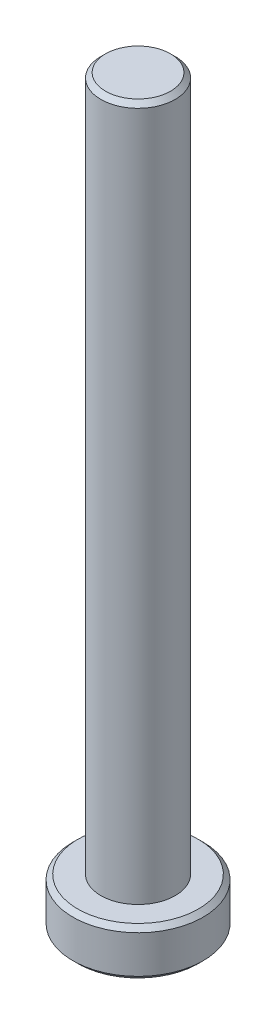
from build123d import *

# Parameters (mm, degrees)
SKETCH1_R           = 2
BOSS_EXTRUDE1_DEPTH = 37.338
SKETCH2_R           = 3.5
BOSS_EXTRUDE2_DEPTH = 2.54
CHAMFER1_SIZE       = 0.254
CHAMFER2_SIZE       = 0.254
CHAMFER3_SIZE       = 0.254


with BuildPart() as part:
    # Sketch1 → Boss-Extrude1 (new body)
    with BuildSketch(Plane(origin=(0, 0, 0), x_dir=(1, 0, 0), z_dir=(0, 1, 0))):
        with Locations(Location((0, 0, 0), (0, 0, 270))):
            Circle(SKETCH1_R)
    extrude(amount=BOSS_EXTRUDE1_DEPTH)

    # Sketch2 → Boss-Extrude2 (add)
    with BuildSketch(Plane.XZ):
        with Locations(Location((0, 0, 0), (0, 0, 270))):
            Circle(SKETCH2_R)
    extrude(amount=BOSS_EXTRUDE2_DEPTH)

    # Chamfer1
    chamfer1_edges = [part.edges().sort_by_distance(p)[0] for p in [
        (0, -2.54, 3.5),
    ]]
    chamfer(chamfer1_edges, length=CHAMFER1_SIZE)

    # Chamfer2
    chamfer2_edges = [part.edges().sort_by_distance(p)[0] for p in [
        (0, 37.338, -2),
    ]]
    chamfer(chamfer2_edges, length=CHAMFER2_SIZE)

    # Chamfer3
    chamfer3_edges = [part.edges().sort_by_distance(p)[0] for p in [
        (0, 0, 3.5),
    ]]
    chamfer(chamfer3_edges, length=CHAMFER3_SIZE)


solid = part.part
